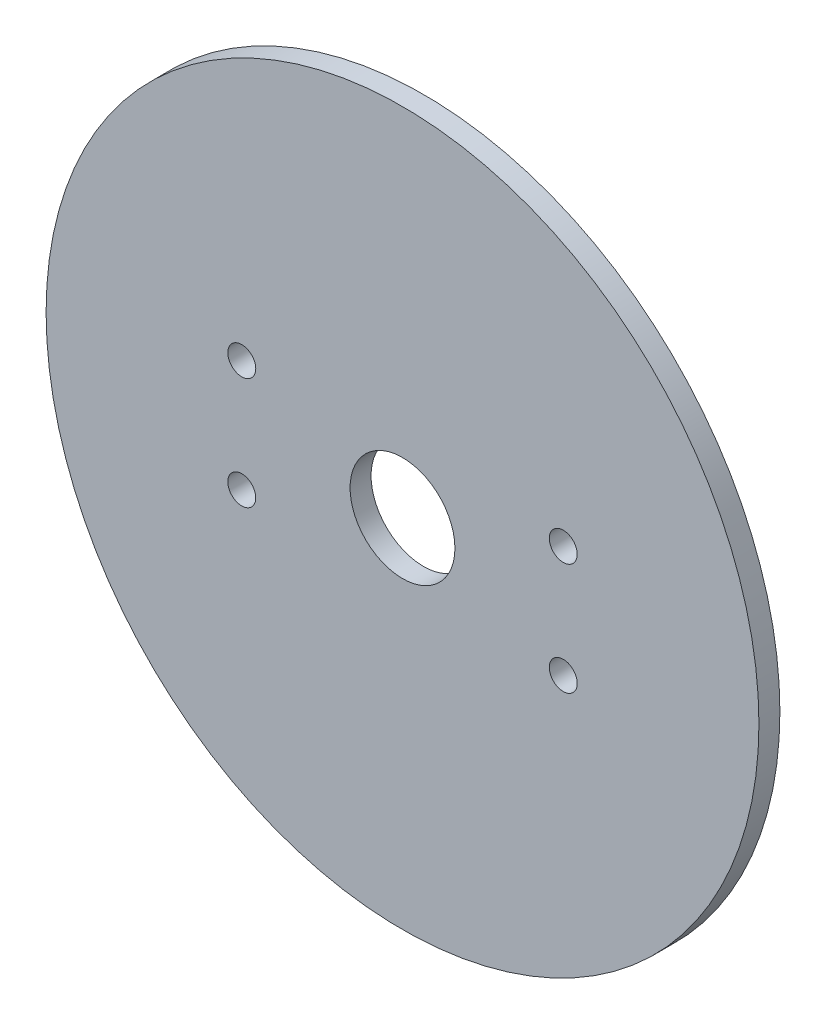
from build123d import *

# Parameters (mm, degrees)
SKETCH_1_R          = 51
EXTRUDE_1_DEPTH     = 3
SKETCH_2_R          = 7.5
CUT_EXTRUDE_1_DEPTH = 3
SKETCH_3_R          = 2
CUT_EXTRUDE_2_DEPTH = 3


with BuildPart() as part:
    # 스케치1 → 보스-돌출1 (new body)
    with BuildSketch(Plane.XY):
        Circle(SKETCH_1_R)
    extrude(amount=EXTRUDE_1_DEPTH)

    # 스케치2 → 컷-돌출1 (cut)
    with BuildSketch(Plane.XY.offset(3)):
        Circle(SKETCH_2_R)
    extrude(amount=-CUT_EXTRUDE_1_DEPTH, mode=Mode.SUBTRACT)

    # 스케치3 → 컷-돌출2 (cut)
    with BuildSketch(Plane.XY.offset(3)):
        with Locations((-23, 8)):
            Circle(SKETCH_3_R)
        with Locations(Location((-23, -8, 0), (0, 0, 180))):
            Circle(SKETCH_3_R)
        with Locations((23, -8)):
            Circle(SKETCH_3_R)
        with Locations(Location((23, 8, 0), (0, 0, 180))):
            Circle(SKETCH_3_R)
    extrude(amount=-CUT_EXTRUDE_2_DEPTH, mode=Mode.SUBTRACT)


solid = part.part
